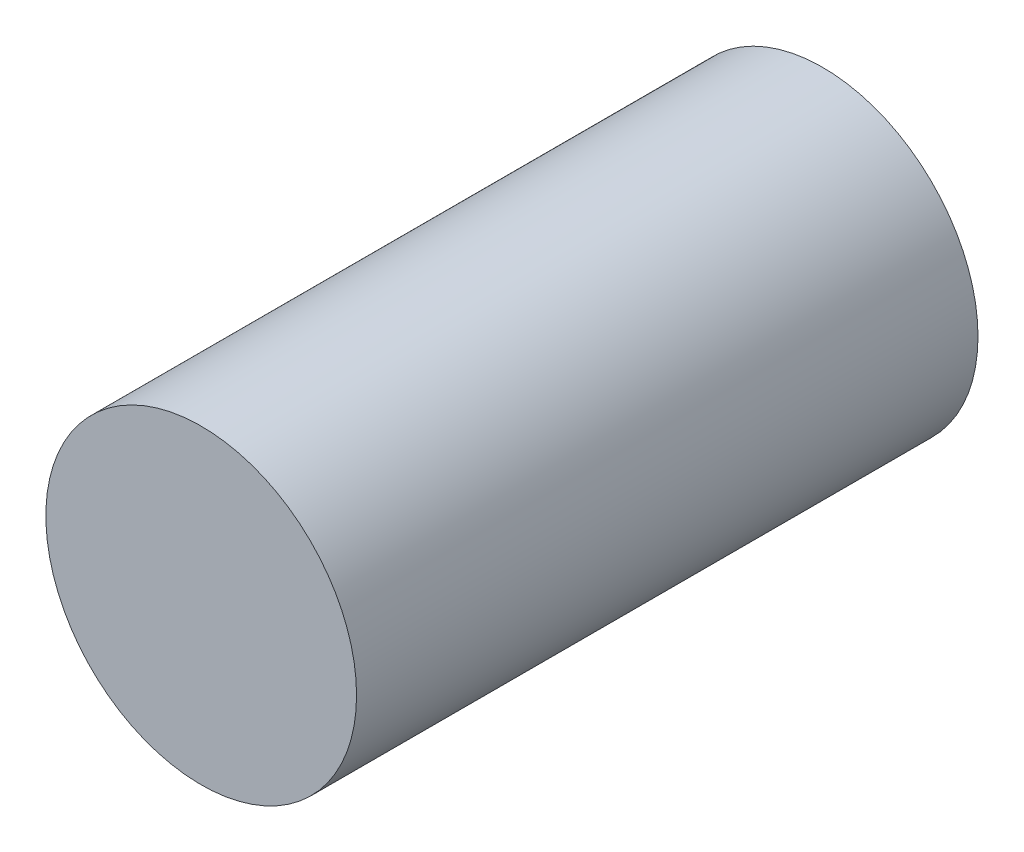
from build123d import *

# Parameters (mm, degrees)
SCHIZZO1_R                   = 7.5
ESTRUSIONE_ESTRUSIONE1_DEPTH = 30


with BuildPart() as part:
    # Schizzo1 → Estrusione-Estrusione1 (new body)
    with BuildSketch(Plane.XY):
        Circle(SCHIZZO1_R)
    extrude(amount=ESTRUSIONE_ESTRUSIONE1_DEPTH)


solid = part.part
